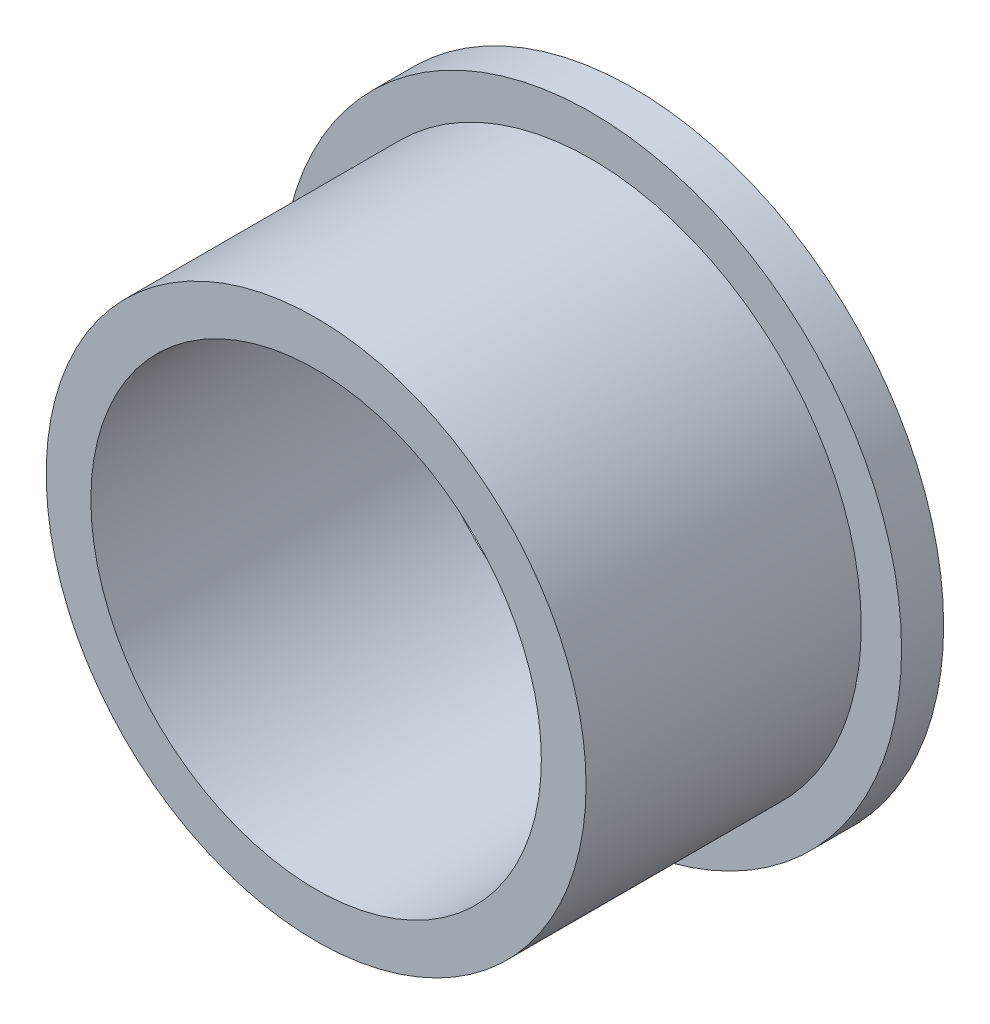
from build123d import *

# Parameters (mm, degrees)
IZIM1_R                     = 17.7
Y_KSEKLIK_EKSTR_ZYON1_DEPTH = 2.4
IZIM2_R                     = 15.4
Y_KSEKLIK_EKSTR_ZYON2_DEPTH = 15.7
IZIM3_R                     = 12.85
KES_EKSTR_ZYON1_DEPTH       = 20


with BuildPart() as part:
    # Çizim1 → Yükseklik-Ekstrüzyon1 (new body)
    with BuildSketch(Plane.XY):
        Circle(IZIM1_R)
    extrude(amount=Y_KSEKLIK_EKSTR_ZYON1_DEPTH)

    # Çizim2 → Yükseklik-Ekstrüzyon2 (add)
    with BuildSketch(Plane.XY.offset(2.4)):
        Circle(IZIM2_R)
    extrude(amount=Y_KSEKLIK_EKSTR_ZYON2_DEPTH)

    # Çizim3 → Kes-Ekstrüzyon1 (cut)
    with BuildSketch(Plane.XY.offset(18.1)):
        Circle(IZIM3_R)
    extrude(amount=-KES_EKSTR_ZYON1_DEPTH, mode=Mode.SUBTRACT)


solid = part.part
